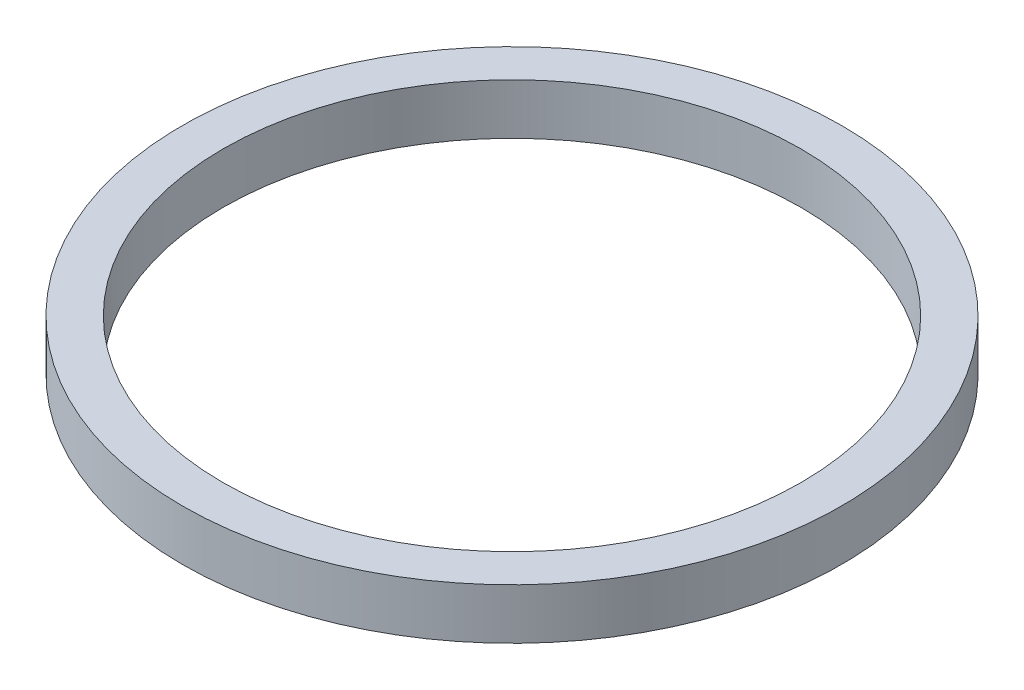
from build123d import *

# Parameters (mm, degrees)
SKETCH1_R           = 20.6375
SKETCH1_R_2         = 18.0975
BOSS_EXTRUDE1_DEPTH = 3.175


with BuildPart() as part:
    # Sketch1 → Boss-Extrude1 (new body)
    with BuildSketch(Plane(origin=(0, 0, 0), x_dir=(1, 0, 0), z_dir=(0, 1, 0))):
        with Locations(Location((0, 0, 0), (0, 0, 270))):
            Circle(SKETCH1_R)
        with Locations(Location((0, 0, 0), (0, 0, 270))):
            Circle(SKETCH1_R_2, mode=Mode.SUBTRACT)
    extrude(amount=BOSS_EXTRUDE1_DEPTH)


solid = part.part
